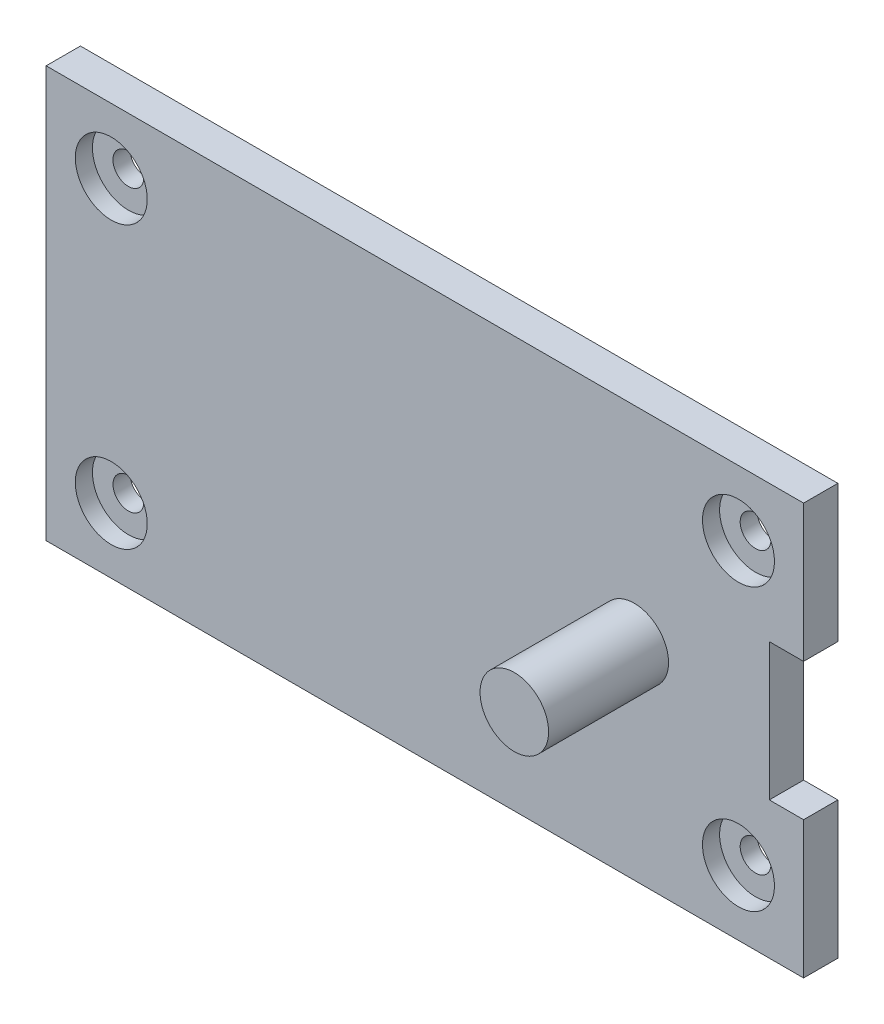
from build123d import *

# Parameters (mm, degrees)
SKETCH1_W           = 44.2
SKETCH1_H           = 24
SKETCH1_W_2         = 40.2
SKETCH1_H_2         = 20
BOSS_EXTRUDE1_DEPTH = 11
SKETCH2_W           = 44.2
SKETCH2_H           = 24
BOSS_EXTRUDE2_DEPTH = 2
SKETCH3_W           = 11
SKETCH3_H           = 8
CUT_EXTRUDE1_DEPTH  = 2
SKETCH4_R           = 2
BOSS_EXTRUDE3_DEPTH = 7
SKETCH5_R           = 0.9
CUT_EXTRUDE2_DEPTH  = 10
SKETCH6_W           = 44.2
SKETCH6_H           = 11
CUT_EXTRUDE3_DEPTH  = 100
SKETCH7_R           = 2.1
CUT_EXTRUDE4_DEPTH  = 1


with BuildPart() as part:
    # Sketch1 → Boss-Extrude1 (new body)
    with BuildSketch(Plane.XY):
        with Locations((20.1, 10)):
            Rectangle(SKETCH1_W, SKETCH1_H)
        with Locations((20.1, 10)):
            Rectangle(SKETCH1_W_2, SKETCH1_H_2, mode=Mode.SUBTRACT)
    extrude(amount=BOSS_EXTRUDE1_DEPTH)

    # Sketch2 → Boss-Extrude2 (add)
    with BuildSketch(Plane.XY.offset(11)):
        with Locations((20.1, 10)):
            Rectangle(SKETCH2_W, SKETCH2_H)
    extrude(amount=BOSS_EXTRUDE2_DEPTH)

    # Sketch3 → Cut-Extrude1 (cut)
    with BuildSketch(Plane(origin=(42.2, 0, 0), x_dir=(0, 0, -1), z_dir=(1, 0, 0))):
        with Locations((-7.5, 10)):
            Rectangle(SKETCH3_W, SKETCH3_H)
    extrude(amount=-CUT_EXTRUDE1_DEPTH, mode=Mode.SUBTRACT)

    # Sketch4 → Boss-Extrude3 (add)
    with BuildSketch(Plane.XY.offset(13)):
        with Locations((32.32, 10)):
            Circle(SKETCH4_R)
    extrude(amount=BOSS_EXTRUDE3_DEPTH)

    # Sketch5 → Cut-Extrude2 (cut)
    with BuildSketch(Plane(origin=(0, 0, 11), x_dir=(-1, 0, 0), z_dir=(0, 0, -1))):
        with Locations((-38.4, 18.2)):
            Circle(SKETCH5_R)
        with Locations(Location((-1.8, 18.2, 0), (0, 0, 180))):
            Circle(SKETCH5_R)
        with Locations((-1.8, 1.8)):
            Circle(SKETCH5_R)
        with Locations(Location((-38.4, 1.8, 0), (0, 0, 180))):
            Circle(SKETCH5_R)
    extrude(amount=-CUT_EXTRUDE2_DEPTH, mode=Mode.SUBTRACT)

    # Sketch6 → Cut-Extrude3 (cut)
    with BuildSketch(Plane(origin=(0, 22, 0), x_dir=(1, 0, 0), z_dir=(0, 1, 0))):
        with Locations((20.1, -5.5)):
            Rectangle(SKETCH6_W, SKETCH6_H)
    extrude(amount=-CUT_EXTRUDE3_DEPTH, mode=Mode.SUBTRACT)

    # Sketch7 → Cut-Extrude4 (cut)
    with BuildSketch(Plane.XY.offset(13)):
        with Locations((1.8, 18.2)):
            Circle(SKETCH7_R)
        with Locations((38.4, 18.2)):
            Circle(SKETCH7_R)
        with Locations((38.4, 1.8)):
            Circle(SKETCH7_R)
        with Locations((1.8, 1.8)):
            Circle(SKETCH7_R)
    extrude(amount=-CUT_EXTRUDE4_DEPTH, mode=Mode.SUBTRACT)


solid = part.part
